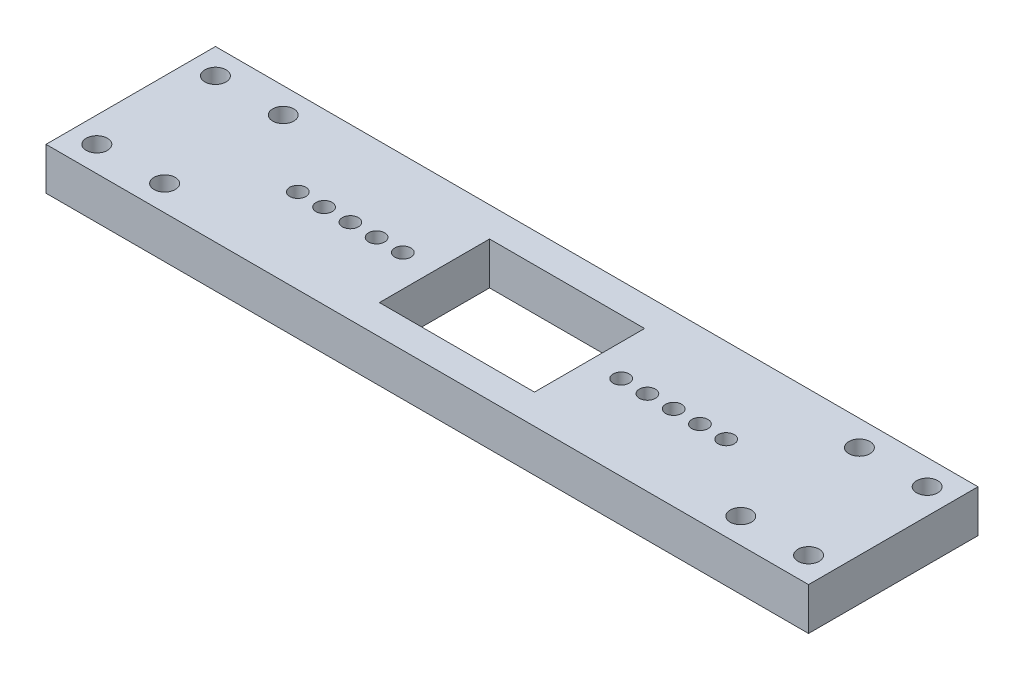
from build123d import *

# Parameters (mm, degrees)
SKETCH1_W           = 90
SKETCH1_H           = 20
SKETCH1_R           = 0.95
SKETCH1_W_2         = 18.3
SKETCH1_H_2         = 13
BOSS_EXTRUDE1_DEPTH = 5
CUT_EXTRUDE1_REACH  = 94.331
SKETCH3_R           = 1.25


with BuildPart() as part:
    # Sketch1 → Boss-Extrude1 (new body)
    with BuildSketch(Plane(origin=(0, 0, 0), x_dir=(1, 0, 0), z_dir=(0, 1, 0))):
        with Locations((45, 10)):
            Rectangle(SKETCH1_W, SKETCH1_H)
        with Locations(Location((57.88, 10, 0), (0, 0, 270))):
            Circle(SKETCH1_R, mode=Mode.SUBTRACT)
        with Locations(Location((60.98, 10, 0), (0, 0, 270))):
            Circle(SKETCH1_R, mode=Mode.SUBTRACT)
        with Locations(Location((64.08, 10, 0), (0, 0, 270))):
            Circle(SKETCH1_R, mode=Mode.SUBTRACT)
        with Locations(Location((67.18, 10, 0), (0, 0, 270))):
            Circle(SKETCH1_R, mode=Mode.SUBTRACT)
        with Locations(Location((70.28, 10, 0), (0, 0, 270))):
            Circle(SKETCH1_R, mode=Mode.SUBTRACT)
        with Locations(Location((19.72, 10, 0), (0, 0, 90))):
            Circle(SKETCH1_R, mode=Mode.SUBTRACT)
        with Locations(Location((22.82, 10, 0), (0, 0, 90))):
            Circle(SKETCH1_R, mode=Mode.SUBTRACT)
        with Locations(Location((25.92, 10, 0), (0, 0, 90))):
            Circle(SKETCH1_R, mode=Mode.SUBTRACT)
        with Locations(Location((29.02, 10, 0), (0, 0, 90))):
            Circle(SKETCH1_R, mode=Mode.SUBTRACT)
        with Locations(Location((32.12, 10, 0), (0, 0, 90))):
            Circle(SKETCH1_R, mode=Mode.SUBTRACT)
        with Locations((45, 10)):
            Rectangle(SKETCH1_W_2, SKETCH1_H_2, mode=Mode.SUBTRACT)
    extrude(amount=BOSS_EXTRUDE1_DEPTH)

    # Sketch3 → Cut-Extrude1 (cut, up to next)
    with BuildSketch(Plane(origin=(0, 5, 0), x_dir=(1, 0, 0), z_dir=(0, 1, 0)), mode=Mode.PRIVATE) as cut_extrude1_sk1:
        with Locations(Location((87, 3, 0), (0, 0, 270))):
            Circle(SKETCH3_R)
    cut_extrude1_tool1 = extrude(cut_extrude1_sk1.sketch, amount=-CUT_EXTRUDE1_REACH, mode=Mode.PRIVATE) & part.part
    # Sketch3 → Cut-Extrude1 (cut, up to next)
    with BuildSketch(Plane(origin=(0, 5, 0), x_dir=(1, 0, 0), z_dir=(0, 1, 0)), mode=Mode.PRIVATE) as cut_extrude1_sk2:
        with Locations(Location((79, 3, 0), (0, 0, 270))):
            Circle(SKETCH3_R)
    cut_extrude1_tool2 = extrude(cut_extrude1_sk2.sketch, amount=-CUT_EXTRUDE1_REACH, mode=Mode.PRIVATE) & part.part
    # Sketch3 → Cut-Extrude1 (cut, up to next)
    with BuildSketch(Plane(origin=(0, 5, 0), x_dir=(1, 0, 0), z_dir=(0, 1, 0)), mode=Mode.PRIVATE) as cut_extrude1_sk3:
        with Locations(Location((79, 17, 0), (0, 0, 90))):
            Circle(SKETCH3_R)
    cut_extrude1_tool3 = extrude(cut_extrude1_sk3.sketch, amount=-CUT_EXTRUDE1_REACH, mode=Mode.PRIVATE) & part.part
    # Sketch3 → Cut-Extrude1 (cut, up to next)
    with BuildSketch(Plane(origin=(0, 5, 0), x_dir=(1, 0, 0), z_dir=(0, 1, 0)), mode=Mode.PRIVATE) as cut_extrude1_sk4:
        with Locations(Location((87, 17, 0), (0, 0, 90))):
            Circle(SKETCH3_R)
    cut_extrude1_tool4 = extrude(cut_extrude1_sk4.sketch, amount=-CUT_EXTRUDE1_REACH, mode=Mode.PRIVATE) & part.part
    # Sketch3 → Cut-Extrude1 (cut, up to next)
    with BuildSketch(Plane(origin=(0, 5, 0), x_dir=(1, 0, 0), z_dir=(0, 1, 0)), mode=Mode.PRIVATE) as cut_extrude1_sk5:
        with Locations(Location((3, 17, 0), (0, 0, 270))):
            Circle(SKETCH3_R)
    cut_extrude1_tool5 = extrude(cut_extrude1_sk5.sketch, amount=-CUT_EXTRUDE1_REACH, mode=Mode.PRIVATE) & part.part
    # Sketch3 → Cut-Extrude1 (cut, up to next)
    with BuildSketch(Plane(origin=(0, 5, 0), x_dir=(1, 0, 0), z_dir=(0, 1, 0)), mode=Mode.PRIVATE) as cut_extrude1_sk6:
        with Locations(Location((11, 17, 0), (0, 0, 270))):
            Circle(SKETCH3_R)
    cut_extrude1_tool6 = extrude(cut_extrude1_sk6.sketch, amount=-CUT_EXTRUDE1_REACH, mode=Mode.PRIVATE) & part.part
    # Sketch3 → Cut-Extrude1 (cut, up to next)
    with BuildSketch(Plane(origin=(0, 5, 0), x_dir=(1, 0, 0), z_dir=(0, 1, 0)), mode=Mode.PRIVATE) as cut_extrude1_sk7:
        with Locations(Location((11, 3, 0), (0, 0, 90))):
            Circle(SKETCH3_R)
    cut_extrude1_tool7 = extrude(cut_extrude1_sk7.sketch, amount=-CUT_EXTRUDE1_REACH, mode=Mode.PRIVATE) & part.part
    # Sketch3 → Cut-Extrude1 (cut, up to next)
    with BuildSketch(Plane(origin=(0, 5, 0), x_dir=(1, 0, 0), z_dir=(0, 1, 0)), mode=Mode.PRIVATE) as cut_extrude1_sk8:
        with Locations(Location((3, 3, 0), (0, 0, 90))):
            Circle(SKETCH3_R)
    cut_extrude1_tool8 = extrude(cut_extrude1_sk8.sketch, amount=-CUT_EXTRUDE1_REACH, mode=Mode.PRIVATE) & part.part
    add(cut_extrude1_tool1.solids().sort_by_distance((87, 5, -3))[0], mode=Mode.SUBTRACT)
    add(cut_extrude1_tool2.solids().sort_by_distance((79, 5, -3))[0], mode=Mode.SUBTRACT)
    add(cut_extrude1_tool3.solids().sort_by_distance((79, 5, -17))[0], mode=Mode.SUBTRACT)
    add(cut_extrude1_tool4.solids().sort_by_distance((87, 5, -17))[0], mode=Mode.SUBTRACT)
    add(cut_extrude1_tool5.solids().sort_by_distance((3, 5, -17))[0], mode=Mode.SUBTRACT)
    add(cut_extrude1_tool6.solids().sort_by_distance((11, 5, -17))[0], mode=Mode.SUBTRACT)
    add(cut_extrude1_tool7.solids().sort_by_distance((11, 5, -3))[0], mode=Mode.SUBTRACT)
    add(cut_extrude1_tool8.solids().sort_by_distance((3, 5, -3))[0], mode=Mode.SUBTRACT)


solid = part.part
